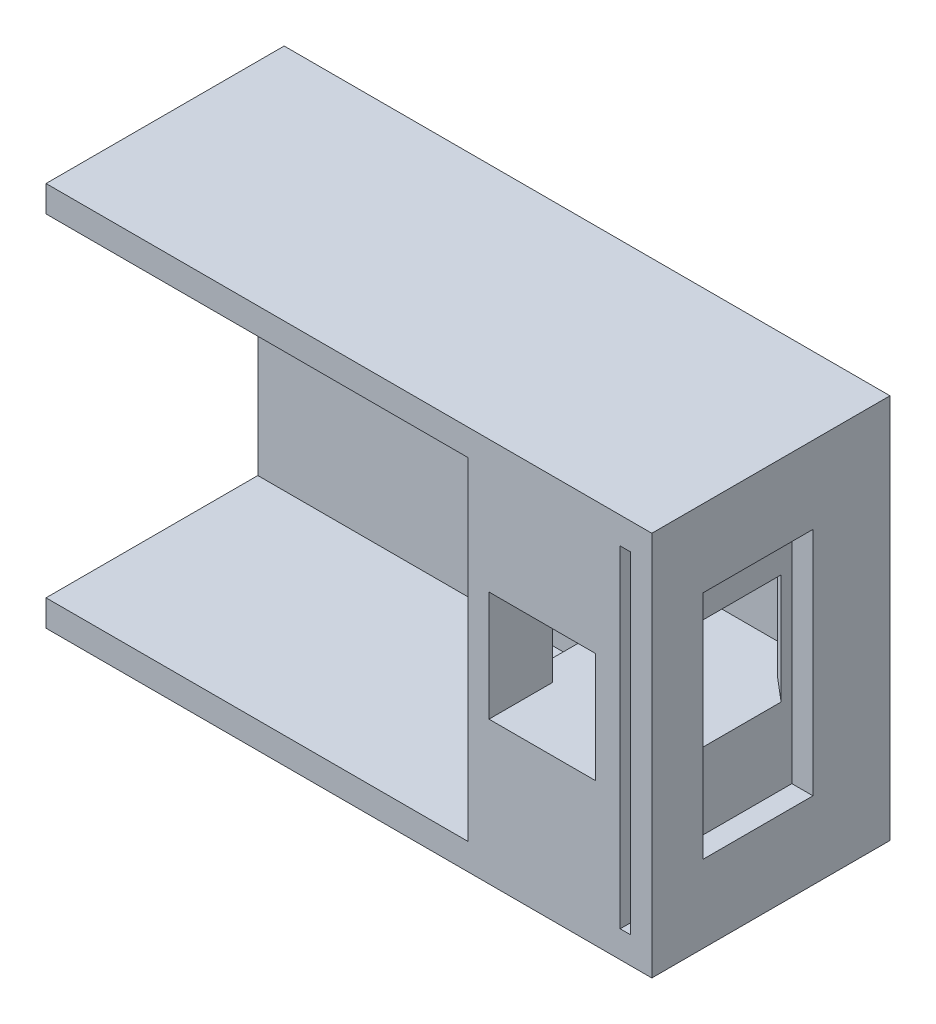
from build123d import *

# Parameters (mm, degrees)
CROQUIS1_W              = 50.8
CROQUIS1_H              = 25.5016
SALIENTE_EXTRUIR1_DEPTH = 3.175
CROQUIS2_W              = 25.5016
CROQUIS2_H              = 46.3804
SALIENTE_EXTRUIR2_DEPTH = 18.3388
CORTAR_EXTRUIR2_DEPTH   = 13.26
SALIENTE_EXTRUIR3_DEPTH = 1.27
CROQUIS6_W              = 25.5016
CROQUIS6_H              = 46.3804
SALIENTE_EXTRUIR4_DEPTH = 2.54
CROQUIS7_W              = 25.5016
CROQUIS7_H              = 3.175
SALIENTE_EXTRUIR5_DEPTH = 50.8
CROQUIS8_W              = 72.9488
CROQUIS8_H              = 46.3804
SALIENTE_EXTRUIR6_DEPTH = 3.175


with BuildPart() as part:
    # Croquis1 → Saliente-Extruir1 (new body)
    with BuildSketch(Plane(origin=(0, 23.1902, 0), x_dir=(1, 0, 0), z_dir=(0, 1, 0))):
        with Locations((76.2, 0)):
            Rectangle(CROQUIS1_W, CROQUIS1_H)
    extrude(amount=-SALIENTE_EXTRUIR1_DEPTH)

    # Croquis2 → Saliente-Extruir2 (add)
    with BuildSketch(Plane(origin=(101.6, 0, 0), x_dir=(0, 0, -1), z_dir=(1, 0, 0))):
        Rectangle(CROQUIS2_W, CROQUIS2_H)
    extrude(amount=SALIENTE_EXTRUIR2_DEPTH)

    # Croquis4 → Cortar-Extruir2 (cut)
    with BuildSketch(Plane(origin=(0, 7.26, 0), x_dir=(1, 0, 0), z_dir=(0, 1, 0))):
        Polygon((104.14, -5.08), (104.14, -12.7508), (116.94, -12.7508), (116.94, -9.1694), (119.9388, -6.6294), (119.9388, 6.6294), (116.94, 9.1694), (116.94, 12.7508), (104.14, 12.7508), (104.14, 5.08), (101.6, 2.54), (101.6, -2.54), align=None)
    extrude(amount=-CORTAR_EXTRUIR2_DEPTH, mode=Mode.SUBTRACT)

    # Croquis5 → Saliente-Extruir3 (add)
    with BuildSketch(Plane(origin=(119.9388, 0, 0), x_dir=(0, 0, -1), z_dir=(1, 0, 0))):
        Polygon((-12.7508, -23.1902), (-12.7508, -19.9644), (12.7, -19.9644), (12.7, 19.9644), (-12.7508, 19.9644), (-12.7508, 23.1902), (12.7508, 23.1902), (12.7508, -23.1902), align=None)
    extrude(amount=SALIENTE_EXTRUIR3_DEPTH)

    # Croquis6 → Saliente-Extruir4 (add)
    with BuildSketch(Plane(origin=(121.2088, 0, 0), x_dir=(0, 0, -1), z_dir=(1, 0, 0))):
        Rectangle(CROQUIS6_W, CROQUIS6_H)
        Polygon((6.651353306, 1.27), (6.651353306, 13.8938), (-6.607446694, 13.8938), (-6.607446694, -13.8938), (6.651353306, -13.8938), align=None, mode=Mode.SUBTRACT)
    extrude(amount=SALIENTE_EXTRUIR4_DEPTH)

    # Croquis7 → Saliente-Extruir5 (add)
    with BuildSketch(Plane.ZY.offset(-101.6)):
        with Locations((0, -21.6027)):
            Rectangle(CROQUIS7_W, CROQUIS7_H)
    extrude(amount=SALIENTE_EXTRUIR5_DEPTH)

    # Croquis8 → Saliente-Extruir6 (add)
    with BuildSketch(Plane(origin=(0, 0, -12.7508), x_dir=(-1, 0, 0), z_dir=(0, 0, -1))):
        with Locations((-87.2744, 0)):
            Rectangle(CROQUIS8_W, CROQUIS8_H)
    extrude(amount=SALIENTE_EXTRUIR6_DEPTH)


solid = part.part
